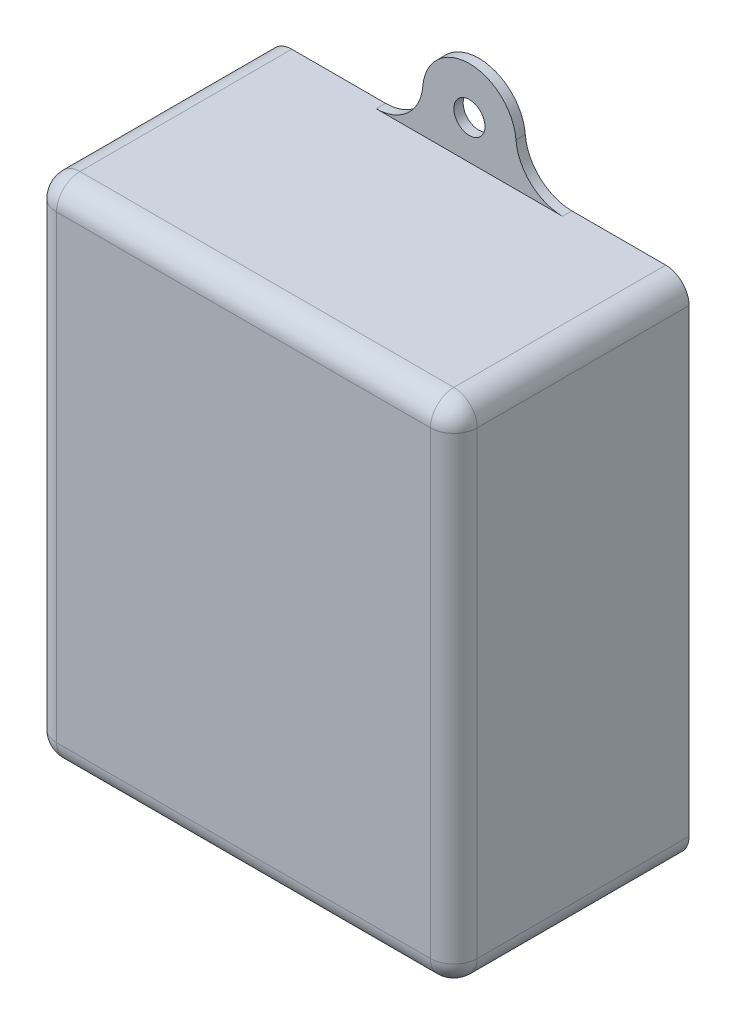
from build123d import *

# Parameters (mm, degrees)
SKETCH_1_R      = 2
EXTRUDE_1_DEPTH = 1.2
SKETCH_5_W      = 54
SKETCH_5_H      = 65
EXTRUDE_2_DEPTH = 29
FILLET_1_R      = 3


with BuildPart() as part:
    # 草图1 → 拉伸1 (new body)
    with BuildSketch(Plane.XY):
        with BuildLine():
            Line((-11.958260743, 32.5), (-27, 32.5))
            Line((-27, 32.5), (-27, -32.5))
            Line((-27, -32.5), (-11.958260743, -32.5))
            ThreePointArc((-11.958260743, -32.5), (-7.896241541, -34.084119567), (-5.979130372, -38))
            ThreePointArc((-5.979130372, -38), (0, -43.5), (5.979130372, -38))
            ThreePointArc((5.979130372, -38), (7.896241541, -34.084119567), (11.958260743, -32.5))
            Line((11.958260743, -32.5), (27, -32.5))
            Line((27, -32.5), (27, 32.5))
            Line((27, 32.5), (11.958260743, 32.5))
            ThreePointArc((11.958260743, 32.5), (7.896241541, 34.084119567), (5.979130372, 38))
            ThreePointArc((5.979130372, 38), (0, 43.5), (-5.979130372, 38))
            ThreePointArc((-5.979130372, 38), (-7.896241541, 34.084119567), (-11.958260743, 32.5))
        make_face()
        with Locations((0, 37.5)):
            Circle(SKETCH_1_R, mode=Mode.SUBTRACT)
        with Locations(Location((0, -37.5, 0), (0, 0, 180))):
            Circle(SKETCH_1_R, mode=Mode.SUBTRACT)
    extrude(amount=EXTRUDE_1_DEPTH)

    # 草图5 → 拉伸2 (add)
    with BuildSketch(Plane.XY.offset(1.2)):
        Rectangle(SKETCH_5_W, SKETCH_5_H)
    extrude(amount=EXTRUDE_2_DEPTH)

    # 圆角1
    fillet_1_edges = [part.edges().sort_by_distance(p)[0] for p in [
        (27, 32.5, 15.1),
        (27, -32.5, 15.1),
        (-27, -32.5, 15.1),
        (-27, 32.5, 15.1),
        (-27, 0, 30.2),
        (0, -32.5, 30.2),
        (27, 0, 30.2),
        (0, 32.5, 30.2),
    ]]
    fillet(fillet_1_edges, radius=FILLET_1_R)


solid = part.part
